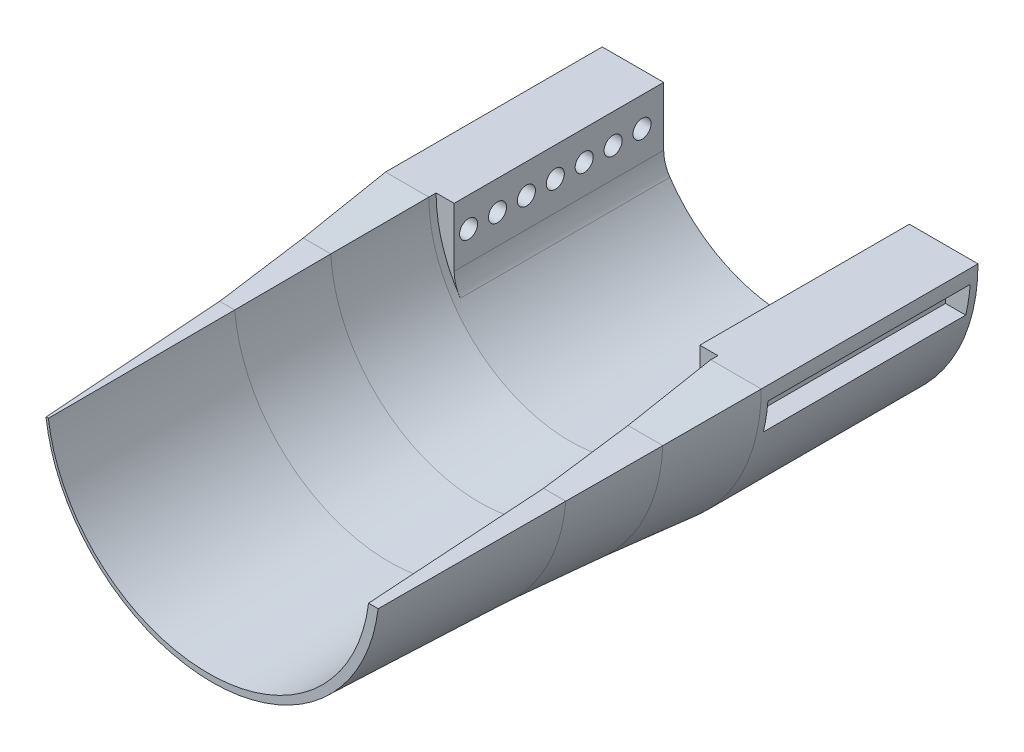
from build123d import *

# Parameters (mm, degrees)
BOSS_EXTRUDE1_DEPTH     = 60
BOSS_EXTRUDE2_DEPTH     = 25
BOSS_EXTRUDE2_TAPER     = 5
BOSS_EXTRUDE3_DEPTH     = 25
BOSS_EXTRUDE3_TAPER     = 4
BOSS_EXTRUDE4_DEPTH     = 50
BOSS_EXTRUDE4_TAPER     = 2
SKETCH5_W               = 5
SKETCH5_H               = 30
BOSS_EXTRUDE5_DEPTH     = 58
FILLET1_R               = 10
CUT_EXTRUDE1_DEPTH      = 189.491379271
CUT_EXTRUDE1_DEPTH_BACK = 189.491379271
SKETCH6_R               = 2.5
CUT_EXTRUDE2_START      = -10
SKETCH7_W               = 56
SKETCH7_H               = 8
CUT_EXTRUDE2_DEPTH      = 58


with BuildPart() as part:
    # Sketch1 → Boss-Extrude1 (new body)
    with BuildSketch(Plane.XY):
        with BuildLine():
            ThreePointArc((38, 0), (-1, -39), (-40, 0))
            Line((-40, 0), (-52, 0))
            ThreePointArc((-52, 0), (0, -52), (52, 0))
            Line((52, 0), (38, 0))
        make_face()
    extrude(amount=BOSS_EXTRUDE1_DEPTH)

    # Sketch2 → Boss-Extrude2 (add)
    with BuildSketch(Plane.XY.offset(60)):
        with BuildLine():
            Line((-40, 0), (-52, 0))
            ThreePointArc((-52, 0), (0, -52), (52, 0))
            Line((52, 0), (38, 0))
            ThreePointArc((38, 0), (-1, -39), (-40, 0))
        make_face()
    extrude(amount=BOSS_EXTRUDE2_DEPTH, taper=BOSS_EXTRUDE2_TAPER)

    # Sketch3 → Boss-Extrude3 (add)
    with BuildSketch(Plane.XY.offset(85)):
        with BuildLine():
            Line((-42.129100329, -2.187216588), (-49.764741282, -2.187216588))
            ThreePointArc((-49.764741282, -2.187216588), (0, -49.812783412), (49.764741282, -2.187216588))
            Line((49.764741282, -2.187216588), (40.129100329, -2.187216588))
            ThreePointArc((40.129100329, -2.187216588), (-1, -41.187216588), (-42.129100329, -2.187216588))
        make_face()
    extrude(amount=BOSS_EXTRUDE3_DEPTH, taper=BOSS_EXTRUDE3_TAPER)

    # Sketch4 → Boss-Extrude4 (add)
    with BuildSketch(Plane.XY.offset(110)):
        with BuildLine():
            Line((-43.754650942, -3.935386887), (-47.903233333, -3.935386887))
            ThreePointArc((-47.903233333, -3.935386887), (0, -48.064613113), (47.903233333, -3.935386887))
            Line((47.903233333, -3.935386887), (41.754650942, -3.935386887))
            ThreePointArc((41.754650942, -3.935386887), (-1, -42.935386887), (-43.754650942, -3.935386887))
        make_face()
    extrude(amount=BOSS_EXTRUDE4_DEPTH, taper=BOSS_EXTRUDE4_TAPER)

    # Sketch5 → Boss-Extrude5 (add)
    with BuildSketch(Plane(origin=(0, 0, 0), x_dir=(-1, 0, 0), z_dir=(0, 0, -1))):
        with Locations((-35.5, -15)):
            Rectangle(SKETCH5_W, SKETCH5_H)
        with Locations((37.5, -15)):
            Rectangle(SKETCH5_W, SKETCH5_H)
    extrude(amount=-BOSS_EXTRUDE5_DEPTH)

    # Fillet1
    fillet1_edges = [part.edges().sort_by_distance(p)[0] for p in [
        (33, -19.104973175, 29),
        (-35, -19.104973175, 29),
    ]]
    fillet(fillet1_edges, radius=FILLET1_R)

    # Sketch6 → Cut-Extrude1 (cut, two sides: drawn at the far end of the back side and taken through both)
    with BuildSketch(Plane.ZY.offset(-33).offset(-CUT_EXTRUDE1_DEPTH_BACK)):
        with Locations(Location((6, -8.14, 0), (0, 0, 270))):
            Circle(SKETCH6_R)
        with Locations(Location((14, -8.14, 0), (0, 0, 270))):
            Circle(SKETCH6_R)
        with Locations(Location((22, -8.14, 0), (0, 0, 270))):
            Circle(SKETCH6_R)
        with Locations(Location((30, -8.14, 0), (0, 0, 270))):
            Circle(SKETCH6_R)
        with Locations(Location((38, -8.14, 0), (0, 0, 270))):
            Circle(SKETCH6_R)
        with Locations(Location((46, -8.14, 0), (0, 0, 270))):
            Circle(SKETCH6_R)
        with Locations(Location((54, -8.14, 0), (0, 0, 270))):
            Circle(SKETCH6_R)
    extrude(amount=CUT_EXTRUDE1_DEPTH + CUT_EXTRUDE1_DEPTH_BACK, mode=Mode.SUBTRACT)

    # Sketch7 → Cut-Extrude2 (cut)
    with BuildSketch(Plane(origin=(-35, 0, 0), x_dir=(0, 0, -1), z_dir=(1, 0, 0)).offset(CUT_EXTRUDE2_START)):
        with Locations((-30, -8)):
            Rectangle(SKETCH7_W, SKETCH7_H)
    cut_extrude2 = extrude(amount=-CUT_EXTRUDE2_DEPTH, mode=Mode.SUBTRACT)

    # Mirror1: Cut-Extrude2 across plane
    add(cut_extrude2.mirror(Plane(origin=(0, 0, 0), x_dir=(0, 0, 1), z_dir=(1, 0, 0))), mode=Mode.SUBTRACT)


solid = part.part
